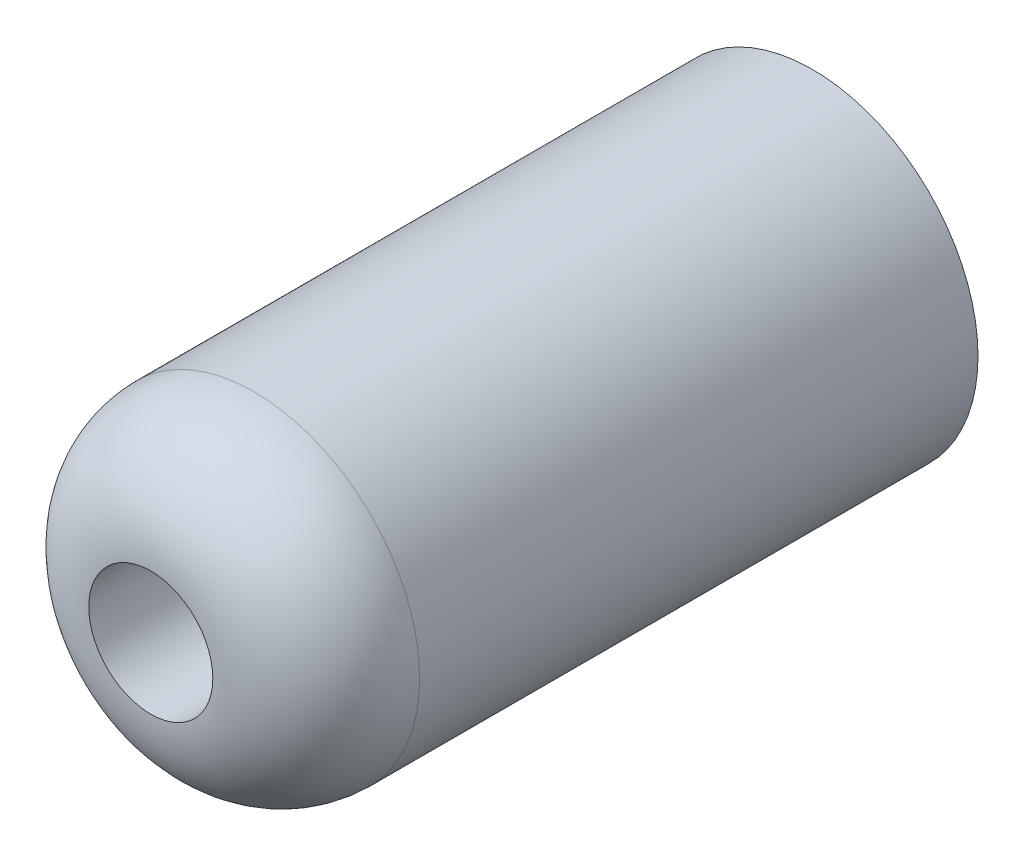
from build123d import *

# Parameters (mm, degrees)
SKETCH1_W = 2
SKETCH1_H = 27


with BuildPart() as part:
    # Sketch1 → Revolve1 (revolve)
    with BuildSketch(Plane.YZ, mode=Mode.PRIVATE) as revolve1_sk:
        with BuildLine():
            ThreePointArc((8, 11), (6.535533906, 14.535533906), (3, 16))
            Line((3, 16), (3, 11))
            Line((3, 11), (6, 11))
            Line((6, 11), (8, 11))
        make_face()
        with Locations((7, -2.5)):
            Rectangle(SKETCH1_W, SKETCH1_H)
    revolve(revolve1_sk.sketch.rotate(Axis((0, 0, 20.787401575), (0, 0, -1)), 90), axis=Axis((0, 0, 20.787401575), (0, 0, -1)))


solid = part.part
